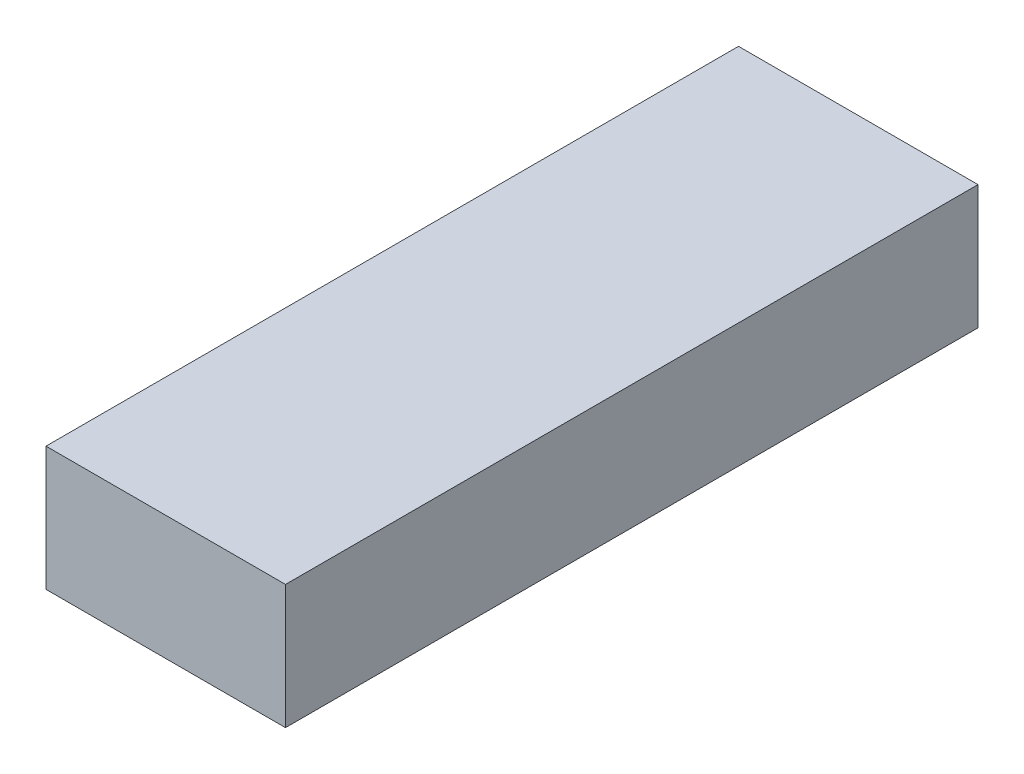
from build123d import *

# Parameters (mm, degrees)
SKETCH1_W           = 33.2
SKETCH1_H           = 17.2
BOSS_EXTRUDE1_DEPTH = 96


with BuildPart() as part:
    # Sketch1 → Boss-Extrude1 (new body)
    with BuildSketch(Plane.XY):
        Rectangle(SKETCH1_W, SKETCH1_H)
    extrude(amount=BOSS_EXTRUDE1_DEPTH)


solid = part.part
